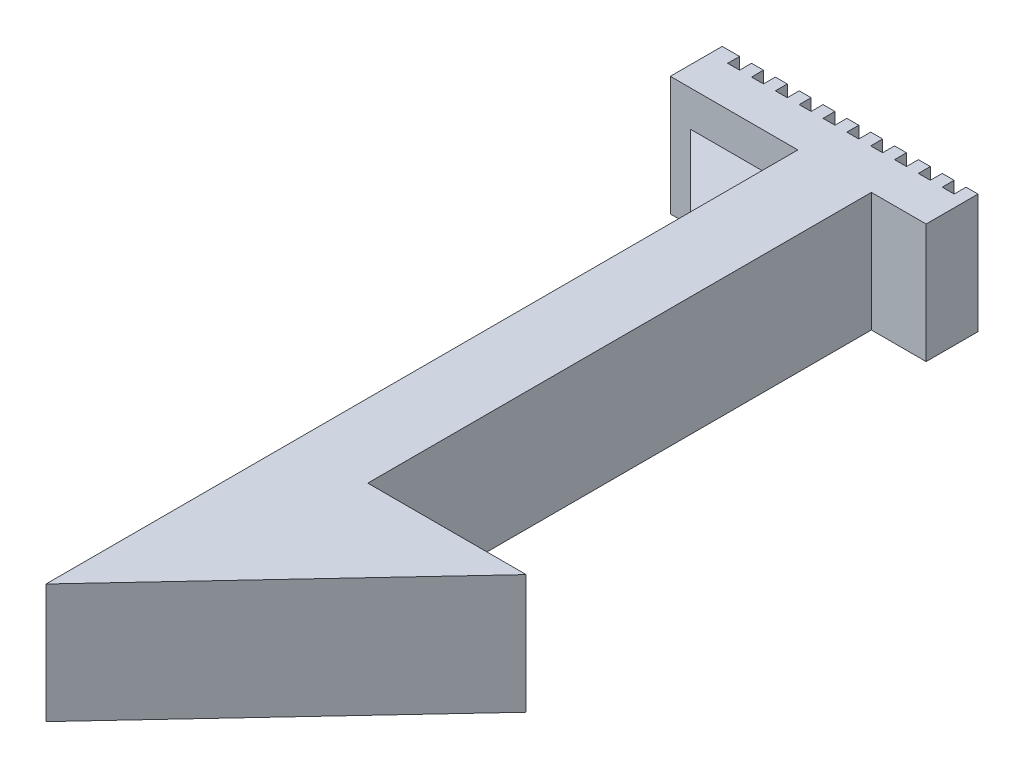
from build123d import *

# Parameters (mm, degrees)
EXTRUDE_1_DEPTH        = 10
EXTRUDE_2_DEPTH        = 2
EXTRUDE_2_DEPTH_BACK   = 2
SKETCH_4_W             = 1
SKETCH_4_H             = 10
CUT_EXTRUDE_2_DEPTH    = 1
PATTERN_LINEAR_2_COUNT = 10
PATTERN_LINEAR_2_PITCH = 2


with BuildPart() as part:
    # Эскиз1 → Бобышка-Вытянуть1 (new body)
    with BuildSketch(Plane(origin=(0, 0, 0), x_dir=(1, 0, 0), z_dir=(0, 1, 0))):
        Polygon((0, 0), (19.459034366, 20.826435939), (6.168868081, 20.826435939), (6.168868081, 63.073215602), (10.762186387, 63.073215602), (10.762186387, 67.42510234), (-10.697117185, 67.42510234), (-10.697117185, 63.073215602), (0, 63.073215602), align=None)
    extrude(amount=EXTRUDE_1_DEPTH)

    # Эскиз3 → Бобышка-Вытянуть2 (add, two sides: drawn at the far end of the back side and taken through both)
    with BuildSketch(Plane(origin=(0, 5, 0), x_dir=(-1, 0, 0), z_dir=(0, -1, 0)).offset(-EXTRUDE_2_DEPTH_BACK)):
        Polygon((9, 63.073215602), (0, 54.073215602), (0, 63.073215602), align=None)
    extrude(amount=EXTRUDE_2_DEPTH + EXTRUDE_2_DEPTH_BACK)

    # Эскиз4 → Вырез-Вытянуть2 (cut)
    with BuildSketch(Plane(origin=(0, 0, -67.42510234), x_dir=(-1, 0, 0), z_dir=(0, 0, -1))):
        with Locations((-9.262186387, 5)):
            Rectangle(SKETCH_4_W, SKETCH_4_H)
    cut_extrude_2 = extrude(amount=-CUT_EXTRUDE_2_DEPTH, mode=Mode.SUBTRACT)

    # Линейный массив2: Вырез-Вытянуть2 ×10
    with Locations(*[(-i * PATTERN_LINEAR_2_PITCH, 0, 0) for i in range(1, PATTERN_LINEAR_2_COUNT)]):
        add(cut_extrude_2, mode=Mode.SUBTRACT)


solid = part.part
